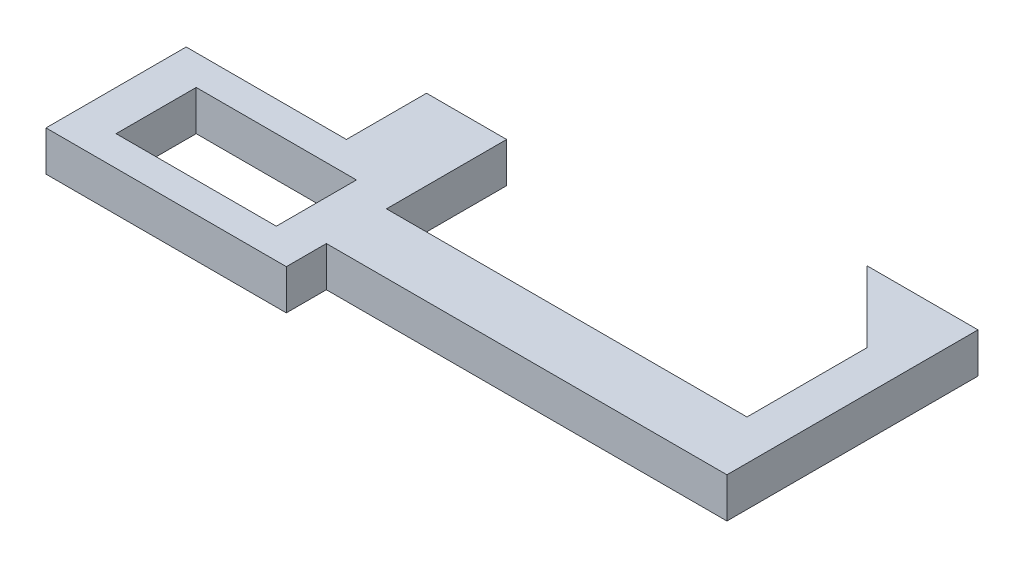
from build123d import *

# Parameters (mm, degrees)
BOSS_EXTRUDE1_DEPTH = 0.5


with BuildPart() as part:
    # Sketch1 → Boss-Extrude1 (new body)
    with BuildSketch(Plane(origin=(0, 0, 0), x_dir=(1, 0, 0), z_dir=(0, 1, 0))):
        Polygon((-23.473296771, 22.192182778), (-27.973296771, 22.192182778), (-27.973296771, 23.692182778), (-28.973296771, 23.692182778), (-28.973296771, 22.692182778), (-30.973296771, 22.692182778), (-30.973296771, 21.817182778), (-30.973296771, 20.942182778), (-27.973296771, 20.942182778), (-27.973296771, 21.442182778), (-22.973296771, 21.442182778), (-22.973296771, 24.576066254), (-24.357180247, 24.576066254), (-23.473296771, 23.692182778), align=None)
        Polygon((-30.473296771, 21.317182778), (-30.473296771, 21.817182778), (-30.473296771, 22.317182778), (-28.473296771, 22.317182778), (-28.473296771, 21.317182778), align=None, mode=Mode.SUBTRACT)
    extrude(amount=BOSS_EXTRUDE1_DEPTH)


solid = part.part
